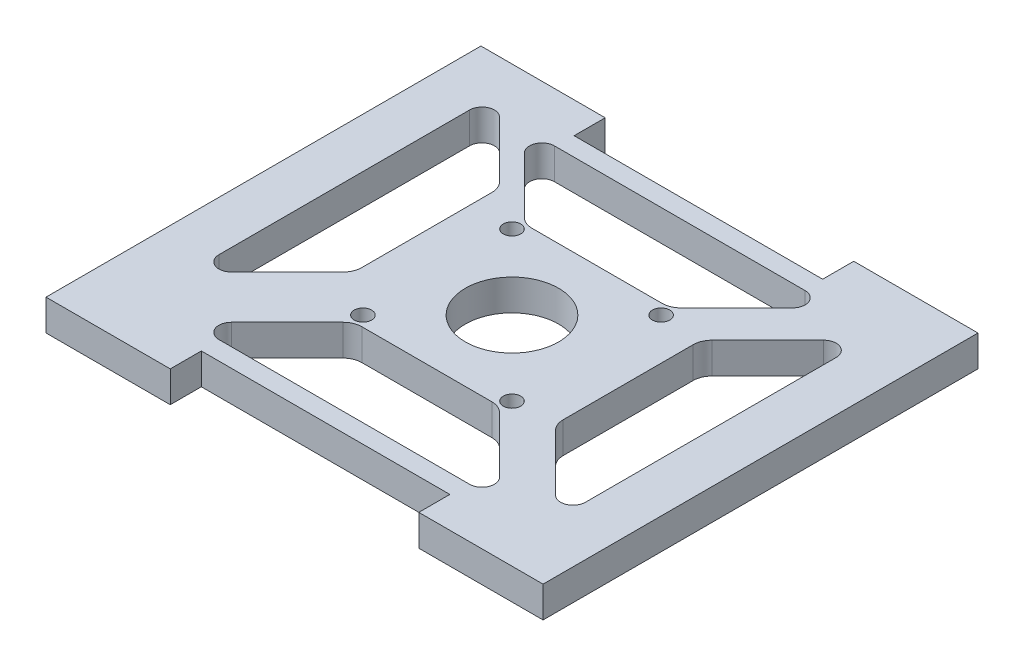
from build123d import *

# Parameters (mm, degrees)
SKETCH1_R           = 1.778
SKETCH1_R_2         = 9.525
BOSS_EXTRUDE1_DEPTH = 6.35
FILLET1_R           = 3.81
FILLET2_R           = 2.54


with BuildPart() as part:
    # Sketch1 → Boss-Extrude1 (new body)
    with BuildSketch(Plane(origin=(0, 0, 0), x_dir=(1, 0, 0), z_dir=(0, 1, 0))):
        Polygon((-25.4, 38.1), (-25.4, 44.45), (-50.8, 44.45), (-50.8, -44.45), (-25.4, -44.45), (-25.4, -38.1), (0, -38.1), (25.4, -38.1), (25.4, -44.45), (50.8, -44.45), (50.8, 0), (50.8, 44.45), (25.4, 44.45), (25.4, 38.1), align=None)
        Polygon((31.75, -34.29), (0, -34.29), (-31.75, -34.29), (-14.867118492, -17.407118492), (14.867118492, -17.407118492), align=None, mode=Mode.SUBTRACT)
        with Locations(Location((-15.24, -15.24, 0), (0, 0, 270))):
            Circle(SKETCH1_R, mode=Mode.SUBTRACT)
        with Locations(Location((15.24, -15.24, 0), (0, 0, 270))):
            Circle(SKETCH1_R, mode=Mode.SUBTRACT)
        with Locations(Location((-15.24, 15.24, 0), (0, 0, 270))):
            Circle(SKETCH1_R, mode=Mode.SUBTRACT)
        with Locations(Location((15.24, 15.24, 0), (0, 0, 270))):
            Circle(SKETCH1_R, mode=Mode.SUBTRACT)
        Polygon((40.64, 31.75), (40.64, 0), (40.64, -31.75), (23.757118492, -14.867118492), (23.757118492, 0), (23.757118492, 14.867118492), align=None, mode=Mode.SUBTRACT)
        Polygon((-40.64, -25.4), (-40.64, 38.1), (-23.757118492, 21.217118492), (-23.757118492, -8.517118492), align=None, mode=Mode.SUBTRACT)
        Polygon((-31.75, 34.29), (31.75, 34.29), (14.867118492, 17.407118492), (-14.867118492, 17.407118492), align=None, mode=Mode.SUBTRACT)
        with Locations(Location((0, 0, 0), (0, 0, 270))):
            Circle(SKETCH1_R_2, mode=Mode.SUBTRACT)
    extrude(amount=BOSS_EXTRUDE1_DEPTH)

    # Fillet1
    fillet1_edges = [part.edges().sort_by_distance(p)[0] for p in [
        (14.867118492, 3.175, -17.407118492),
        (-14.867118492, 3.175, -17.407118492),
        (14.867118492, 3.175, 17.407118492),
        (-14.867118492, 3.175, 17.407118492),
        (23.757118492, 3.175, -14.867118492),
        (23.757118492, 3.175, 14.867118492),
        (-23.757118492, 3.175, 8.517118492),
        (-23.757118492, 3.175, -21.217118492),
    ]]
    fillet(fillet1_edges, radius=FILLET1_R)

    # Fillet2
    fillet2_edges = [part.edges().sort_by_distance(p)[0] for p in [
        (31.75, 3.175, -34.29),
        (-31.75, 3.175, -34.29),
        (-31.75, 3.175, 34.29),
        (31.75, 3.175, 34.29),
        (40.64, 3.175, -31.75),
        (40.64, 3.175, 31.75),
        (-40.64, 3.175, 25.4),
        (-40.64, 3.175, -38.1),
    ]]
    fillet(fillet2_edges, radius=FILLET2_R)


solid = part.part
